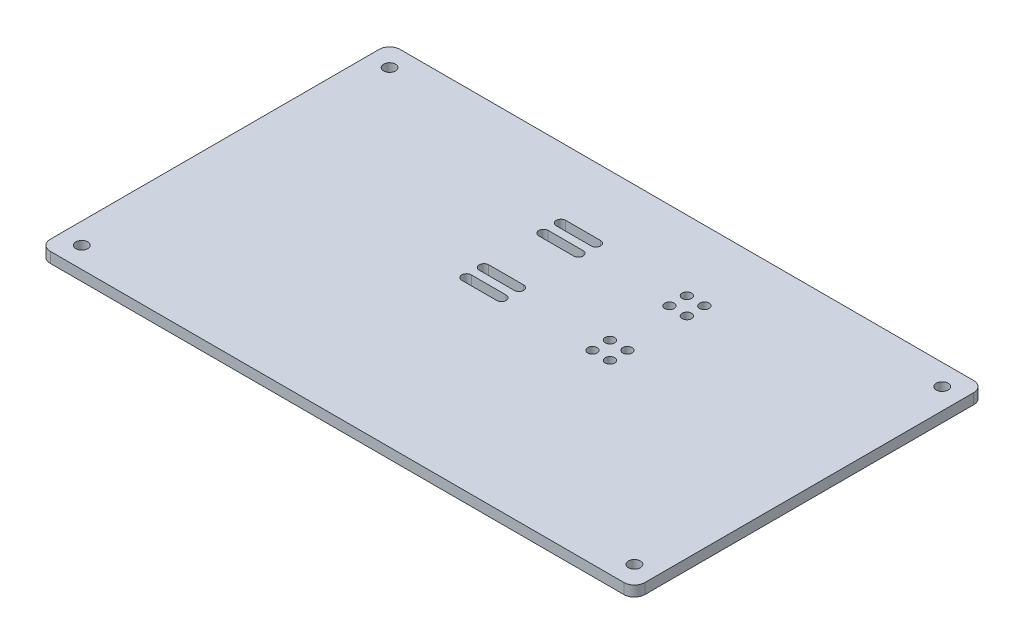
from build123d import *

# Parameters (mm, degrees)
SKETCH_1_W          = 170
SKETCH_1_H          = 100
SKETCH_1_R          = 1.7
EXTRUDE_1_DEPTH     = 3
CUT_EXTRUDE_1_REACH = 100.661
SKETCH_2_R          = 1.35
FILLET_1_R          = 3


with BuildPart() as part:
    # 草图1 → 凸台-拉伸1 (new body)
    with BuildSketch(Plane(origin=(0, 0, 0), x_dir=(1, 0, 0), z_dir=(0, 1, 0))):
        Rectangle(SKETCH_1_W, SKETCH_1_H)
        with Locations(Location((-79, -44, 0), (0, 0, 90))):
            Circle(SKETCH_1_R, mode=Mode.SUBTRACT)
        with Locations(Location((79, 44, 0), (0, 0, 90))):
            Circle(SKETCH_1_R, mode=Mode.SUBTRACT)
        with Locations(Location((79, -44, 0), (0, 0, 270))):
            Circle(SKETCH_1_R, mode=Mode.SUBTRACT)
        with Locations(Location((-79, 44, 0), (0, 0, 270))):
            Circle(SKETCH_1_R, mode=Mode.SUBTRACT)
    extrude(amount=EXTRUDE_1_DEPTH)

    # 草图2 → 切除-拉伸1 (cut, up to next)
    with BuildSketch(Plane(origin=(0, 3, 0), x_dir=(1, 0, 0), z_dir=(0, 1, 0)), mode=Mode.PRIVATE) as cut_extrude_1_sk1:
        with Locations(Location((25, 30, 0), (0, 0, 270))):
            Circle(SKETCH_2_R)
    cut_extrude_1_tool1 = extrude(cut_extrude_1_sk1.sketch, amount=-CUT_EXTRUDE_1_REACH, mode=Mode.PRIVATE) & part.part
    # 草图2 → 切除-拉伸1 (cut, up to next)
    with BuildSketch(Plane(origin=(0, 3, 0), x_dir=(1, 0, 0), z_dir=(0, 1, 0)), mode=Mode.PRIVATE) as cut_extrude_1_sk2:
        with Locations(Location((20, 30, 0), (0, 0, 270))):
            Circle(SKETCH_2_R)
    cut_extrude_1_tool2 = extrude(cut_extrude_1_sk2.sketch, amount=-CUT_EXTRUDE_1_REACH, mode=Mode.PRIVATE) & part.part
    # 草图2 → 切除-拉伸1 (cut, up to next)
    with BuildSketch(Plane(origin=(0, 3, 0), x_dir=(1, 0, 0), z_dir=(0, 1, 0)), mode=Mode.PRIVATE) as cut_extrude_1_sk3:
        with Locations(Location((25, 25, 0), (0, 0, 270))):
            Circle(SKETCH_2_R)
    cut_extrude_1_tool3 = extrude(cut_extrude_1_sk3.sketch, amount=-CUT_EXTRUDE_1_REACH, mode=Mode.PRIVATE) & part.part
    # 草图2 → 切除-拉伸1 (cut, up to next)
    with BuildSketch(Plane(origin=(0, 3, 0), x_dir=(1, 0, 0), z_dir=(0, 1, 0)), mode=Mode.PRIVATE) as cut_extrude_1_sk4:
        with Locations(Location((20, 25, 0), (0, 0, 270))):
            Circle(SKETCH_2_R)
    cut_extrude_1_tool4 = extrude(cut_extrude_1_sk4.sketch, amount=-CUT_EXTRUDE_1_REACH, mode=Mode.PRIVATE) & part.part
    # 草图2 → 切除-拉伸1 (cut, up to next)
    with BuildSketch(Plane(origin=(0, 3, 0), x_dir=(1, 0, 0), z_dir=(0, 1, 0)), mode=Mode.PRIVATE) as cut_extrude_1_sk5:
        with Locations(Location((25, 8, 0), (0, 0, 270))):
            Circle(SKETCH_2_R)
    cut_extrude_1_tool5 = extrude(cut_extrude_1_sk5.sketch, amount=-CUT_EXTRUDE_1_REACH, mode=Mode.PRIVATE) & part.part
    # 草图2 → 切除-拉伸1 (cut, up to next)
    with BuildSketch(Plane(origin=(0, 3, 0), x_dir=(1, 0, 0), z_dir=(0, 1, 0)), mode=Mode.PRIVATE) as cut_extrude_1_sk6:
        with Locations(Location((20, 8, 0), (0, 0, 270))):
            Circle(SKETCH_2_R)
    cut_extrude_1_tool6 = extrude(cut_extrude_1_sk6.sketch, amount=-CUT_EXTRUDE_1_REACH, mode=Mode.PRIVATE) & part.part
    # 草图2 → 切除-拉伸1 (cut, up to next)
    with BuildSketch(Plane(origin=(0, 3, 0), x_dir=(1, 0, 0), z_dir=(0, 1, 0)), mode=Mode.PRIVATE) as cut_extrude_1_sk7:
        with Locations(Location((25, 3, 0), (0, 0, 270))):
            Circle(SKETCH_2_R)
    cut_extrude_1_tool7 = extrude(cut_extrude_1_sk7.sketch, amount=-CUT_EXTRUDE_1_REACH, mode=Mode.PRIVATE) & part.part
    # 草图2 → 切除-拉伸1 (cut, up to next)
    with BuildSketch(Plane(origin=(0, 3, 0), x_dir=(1, 0, 0), z_dir=(0, 1, 0)), mode=Mode.PRIVATE) as cut_extrude_1_sk8:
        with Locations(Location((20, 3, 0), (0, 0, 270))):
            Circle(SKETCH_2_R)
    cut_extrude_1_tool8 = extrude(cut_extrude_1_sk8.sketch, amount=-CUT_EXTRUDE_1_REACH, mode=Mode.PRIVATE) & part.part
    # 草图2 → 切除-拉伸1 (cut, up to next)
    with BuildSketch(Plane(origin=(0, 3, 0), x_dir=(1, 0, 0), z_dir=(0, 1, 0)), mode=Mode.PRIVATE) as cut_extrude_1_sk9:
        with BuildLine():
            Line((-16, 26.35), (-6, 26.35))
            ThreePointArc((-6, 26.35), (-4.65, 25), (-6, 23.65))
            Line((-6, 23.65), (-16, 23.65))
            ThreePointArc((-16, 23.65), (-17.35, 25), (-16, 26.35))
        make_face()
    cut_extrude_1_tool9 = extrude(cut_extrude_1_sk9.sketch, amount=-CUT_EXTRUDE_1_REACH, mode=Mode.PRIVATE) & part.part
    # 草图2 → 切除-拉伸1 (cut, up to next)
    with BuildSketch(Plane(origin=(0, 3, 0), x_dir=(1, 0, 0), z_dir=(0, 1, 0)), mode=Mode.PRIVATE) as cut_extrude_1_sk10:
        with BuildLine():
            Line((-16, 31.35), (-6, 31.35))
            ThreePointArc((-6, 31.35), (-4.65, 30), (-6, 28.65))
            Line((-6, 28.65), (-16, 28.65))
            ThreePointArc((-16, 28.65), (-17.35, 30), (-16, 31.35))
        make_face()
    cut_extrude_1_tool10 = extrude(cut_extrude_1_sk10.sketch, amount=-CUT_EXTRUDE_1_REACH, mode=Mode.PRIVATE) & part.part
    # 草图2 → 切除-拉伸1 (cut, up to next)
    with BuildSketch(Plane(origin=(0, 3, 0), x_dir=(1, 0, 0), z_dir=(0, 1, 0)), mode=Mode.PRIVATE) as cut_extrude_1_sk11:
        with BuildLine():
            Line((-16, 4.35), (-6, 4.35))
            ThreePointArc((-6, 4.35), (-4.65, 3), (-6, 1.65))
            Line((-6, 1.65), (-16, 1.65))
            ThreePointArc((-16, 1.65), (-17.35, 3), (-16, 4.35))
        make_face()
    cut_extrude_1_tool11 = extrude(cut_extrude_1_sk11.sketch, amount=-CUT_EXTRUDE_1_REACH, mode=Mode.PRIVATE) & part.part
    # 草图2 → 切除-拉伸1 (cut, up to next)
    with BuildSketch(Plane(origin=(0, 3, 0), x_dir=(1, 0, 0), z_dir=(0, 1, 0)), mode=Mode.PRIVATE) as cut_extrude_1_sk12:
        with BuildLine():
            Line((-16, 9.35), (-6, 9.35))
            ThreePointArc((-6, 9.35), (-4.65, 8), (-6, 6.65))
            Line((-6, 6.65), (-16, 6.65))
            ThreePointArc((-16, 6.65), (-17.35, 8), (-16, 9.35))
        make_face()
    cut_extrude_1_tool12 = extrude(cut_extrude_1_sk12.sketch, amount=-CUT_EXTRUDE_1_REACH, mode=Mode.PRIVATE) & part.part
    add(cut_extrude_1_tool1.solids().sort_by_distance((25, 3, -30))[0], mode=Mode.SUBTRACT)
    add(cut_extrude_1_tool2.solids().sort_by_distance((20, 3, -30))[0], mode=Mode.SUBTRACT)
    add(cut_extrude_1_tool3.solids().sort_by_distance((25, 3, -25))[0], mode=Mode.SUBTRACT)
    add(cut_extrude_1_tool4.solids().sort_by_distance((20, 3, -25))[0], mode=Mode.SUBTRACT)
    add(cut_extrude_1_tool5.solids().sort_by_distance((25, 3, -8))[0], mode=Mode.SUBTRACT)
    add(cut_extrude_1_tool6.solids().sort_by_distance((20, 3, -8))[0], mode=Mode.SUBTRACT)
    add(cut_extrude_1_tool7.solids().sort_by_distance((25, 3, -3))[0], mode=Mode.SUBTRACT)
    add(cut_extrude_1_tool8.solids().sort_by_distance((20, 3, -3))[0], mode=Mode.SUBTRACT)
    add(cut_extrude_1_tool9.solids().sort_by_distance((-11, 3, -25))[0], mode=Mode.SUBTRACT)
    add(cut_extrude_1_tool10.solids().sort_by_distance((-11, 3, -30))[0], mode=Mode.SUBTRACT)
    add(cut_extrude_1_tool11.solids().sort_by_distance((-11, 3, -3))[0], mode=Mode.SUBTRACT)
    add(cut_extrude_1_tool12.solids().sort_by_distance((-11, 3, -8))[0], mode=Mode.SUBTRACT)

    # 圆角1
    fillet_1_edges = [part.edges().sort_by_distance(p)[0] for p in [
        (85, 1.5, 50),
        (-85, 1.5, 50),
        (-85, 1.5, -50),
        (85, 1.5, -50),
    ]]
    fillet(fillet_1_edges, radius=FILLET_1_R)


solid = part.part
